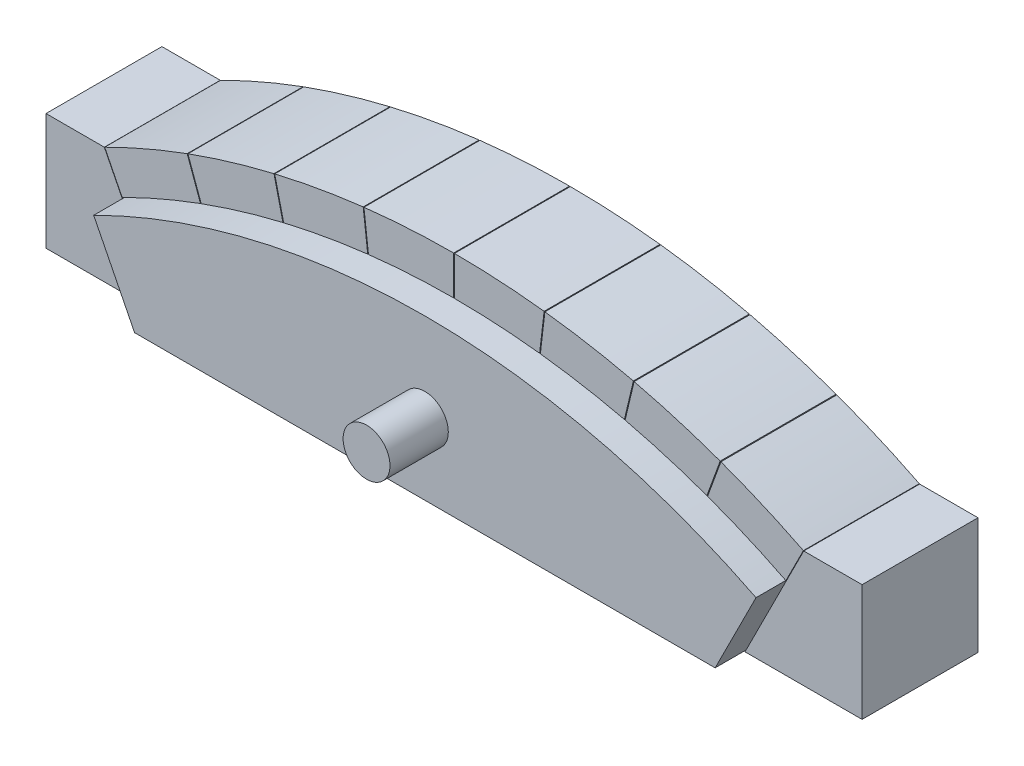
from build123d import *

# Parameters (mm, degrees)
BOSS_EXTRUDE1_DEPTH    = 29.8
BOSS_EXTRUDE1_2_DEPTH  = 29.8
BOSS_EXTRUDE1_3_DEPTH  = 29.8
BOSS_EXTRUDE1_4_DEPTH  = 29.8
BOSS_EXTRUDE1_5_DEPTH  = 29.8
BOSS_EXTRUDE1_6_DEPTH  = 29.8
BOSS_EXTRUDE1_7_DEPTH  = 29.8
BOSS_EXTRUDE1_8_DEPTH  = 29.8
BOSS_EXTRUDE1_9_DEPTH  = 29.8
BOSS_EXTRUDE1_10_DEPTH = 29.8
BOSS_EXTRUDE2_DEPTH    = 7.5
SKETCH3_R              = 6.027124085
BOSS_EXTRUDE3_DEPTH    = 15


with BuildPart() as part:
    # Sketch1 → Boss-Extrude1 (new body)
    with BuildSketch(Plane.XY):
        Polygon((0, 0), (0, 30), (15, 30), (30.096044914, 0), align=None)
    extrude(amount=BOSS_EXTRUDE1_DEPTH)


with BuildPart() as body_2:
    # Sketch1 → Boss-Extrude1 2 (new body)
    with BuildSketch(Plane.XY):
        Polygon((179.703955086, 0), (209.8, 0), (209.8, 30), (194.8, 30), align=None)
    extrude(amount=BOSS_EXTRUDE1_2_DEPTH)


with BuildPart() as body_3:
    # Sketch1 → Boss-Extrude1 3 (new body)
    with BuildSketch(Plane.XY):
        with BuildLine():
            Line((15.089339271, 30.044927668), (19.584339271, 21.112124357))
            ThreePointArc((19.584339271, 21.112124357), (29.525121598, 25.753303377), (39.717208561, 29.812990475))
            Line((39.717208561, 29.812990475), (36.291479568, 39.207902974))
            ThreePointArc((36.291479568, 39.207902974), (25.558023285, 34.932742611), (15.089339271, 30.044927668))
        make_face()
    extrude(amount=BOSS_EXTRUDE1_3_DEPTH)


with BuildPart() as body_4:
    # Sketch1 → Boss-Extrude1 4 (new body)
    with BuildSketch(Plane.XY):
        with BuildLine():
            Line((36.479377818, 39.276417553), (39.905106811, 29.881505054))
            ThreePointArc((39.905106811, 29.881505054), (50.318158586, 33.335205782), (60.913189689, 36.182136043))
            Line((60.913189689, 36.182136043), (58.603214918, 45.911679535))
            ThreePointArc((58.603214918, 45.911679535), (47.445430489, 42.913692456), (36.479377818, 39.276417553))
        make_face()
    extrude(amount=BOSS_EXTRUDE1_4_DEPTH)


with BuildPart() as body_5:
    # Sketch1 → Boss-Extrude1 5 (new body)
    with BuildSketch(Plane.XY):
        with BuildLine():
            Line((58.797805788, 45.95787903), (61.107780559, 36.228335538))
            ThreePointArc((61.107780559, 36.228335538), (71.851808604, 38.447695213), (82.706021419, 40.043239056))
            Line((82.706021419, 40.043239056), (81.54314458, 49.975394787))
            ThreePointArc((81.54314458, 49.975394787), (70.11243035, 48.295260241), (58.797805788, 45.95787903))
        make_face()
    extrude(amount=BOSS_EXTRUDE1_5_DEPTH)


with BuildPart() as body_6:
    # Sketch1 → Boss-Extrude1 6 (new body)
    with BuildSketch(Plane.XY):
        with BuildLine():
            Line((81.741787695, 49.998652324), (82.904664533, 40.066496593))
            ThreePointArc((82.904664533, 40.066496593), (93.833884701, 41.021401048), (104.8, 41.343908772))
            Line((104.8, 41.343908772), (104.8, 51.343908772))
            ThreePointArc((104.8, 51.343908772), (93.25145766, 51.004424259), (81.741787695, 49.998652324))
        make_face()
    extrude(amount=BOSS_EXTRUDE1_6_DEPTH)


with BuildPart() as body_7:
    # Sketch1 → Boss-Extrude1 7 (new body)
    with BuildSketch(Plane.XY):
        with BuildLine():
            Line((105, 51.343908772), (105, 41.343908772))
            ThreePointArc((105, 41.343908772), (115.966115299, 41.021401048), (126.895335467, 40.066496593))
            Line((126.895335467, 40.066496593), (128.058212305, 49.998652324))
            ThreePointArc((128.058212305, 49.998652324), (116.54854234, 51.004424259), (105, 51.343908772))
        make_face()
    extrude(amount=BOSS_EXTRUDE1_7_DEPTH)


with BuildPart() as body_8:
    # Sketch1 → Boss-Extrude1 8 (new body)
    with BuildSketch(Plane.XY):
        with BuildLine():
            Line((128.25685542, 49.975394787), (127.093978581, 40.043239056))
            ThreePointArc((127.093978581, 40.043239056), (137.948191396, 38.447695213), (148.692219441, 36.228335538))
            Line((148.692219441, 36.228335538), (151.002194212, 45.95787903))
            ThreePointArc((151.002194212, 45.95787903), (139.68756965, 48.295260241), (128.25685542, 49.975394787))
        make_face()
    extrude(amount=BOSS_EXTRUDE1_8_DEPTH)


with BuildPart() as body_9:
    # Sketch1 → Boss-Extrude1 9 (new body)
    with BuildSketch(Plane.XY):
        with BuildLine():
            Line((151.196785082, 45.911679535), (148.886810311, 36.182136043))
            ThreePointArc((148.886810311, 36.182136043), (159.481841414, 33.335205782), (169.894893189, 29.881505054))
            Line((169.894893189, 29.881505054), (173.320622182, 39.276417553))
            ThreePointArc((173.320622182, 39.276417553), (162.354569511, 42.913692456), (151.196785082, 45.911679535))
        make_face()
    extrude(amount=BOSS_EXTRUDE1_9_DEPTH)


with BuildPart() as body_10:
    # Sketch1 → Boss-Extrude1 10 (new body)
    with BuildSketch(Plane.XY):
        with BuildLine():
            Line((173.508520432, 39.207902974), (170.082791439, 29.812990475))
            ThreePointArc((170.082791439, 29.812990475), (180.274878402, 25.753303377), (190.215660729, 21.112124357))
            Line((190.215660729, 21.112124357), (194.710660729, 30.044927668))
            ThreePointArc((194.710660729, 30.044927668), (184.241976715, 34.932742611), (173.508520432, 39.207902974))
        make_face()
    extrude(amount=BOSS_EXTRUDE1_10_DEPTH)


with BuildPart() as body_11:
    # Sketch2 → Boss-Extrude2 (new, symmetric)
    with BuildSketch(Plane.XY.offset(29.8)):
        with BuildLine():
            Line((30.274700981, 0.0899), (19.76360284, 20.978347669))
            ThreePointArc((19.76360284, 20.978347669), (104.9, 41.143935088), (190.03639716, 20.978347669))
            Line((190.03639716, 20.978347669), (179.525299019, 0.0899))
            Line((179.525299019, 0.0899), (30.274700981, 0.0899))
        make_face()
    extrude(amount=BOSS_EXTRUDE2_DEPTH, both=True)

    # Sketch3 → Boss-Extrude3 (add)
    with BuildSketch(Plane.XY.offset(37.3)):
        with Locations((104.9, 18.306428262)):
            Circle(SKETCH3_R)
    extrude(amount=BOSS_EXTRUDE3_DEPTH)


solid = Compound([part.part, body_2.part, body_3.part, body_4.part, body_5.part, body_6.part, body_7.part, body_8.part, body_9.part, body_10.part, body_11.part])
